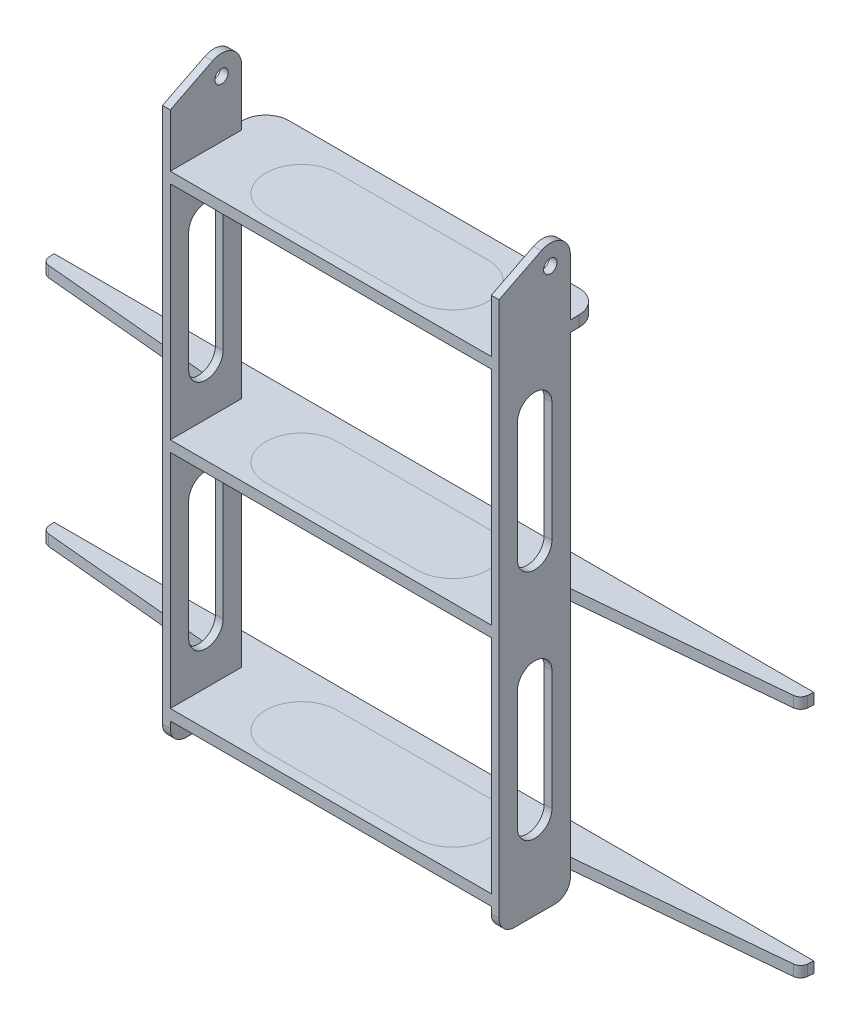
from build123d import *

# Parameters (mm, degrees)
SKETCH1_W               = 1237.47
SKETCH1_H               = 14
BOSS_EXTRUDE1_DEPTH     = 133
LPATTERN1_COUNT         = 3
LPATTERN1_PITCH         = 300
CUT_EXTRUDE1_DEPTH      = 882.76981136
CUT_EXTRUDE1_DEPTH_BACK = 882.76981136
SKETCH3_W               = 91.96189972
SKETCH3_H               = 741.26
BOSS_EXTRUDE2_DEPTH     = 10
SKETCH4_W               = 289.906679044
SKETCH4_H               = 376.133897458
CUT_EXTRUDE3_DEPTH      = 105
CUT_EXTRUDE5_DEPTH      = 960.881700163
CUT_EXTRUDE5_DEPTH_BACK = 960.881700163
SKETCH5_R               = 8.65
FILLET1_R               = 30
FILLET2_R               = 20
FILLET3_R               = 10
CUT_EXTRUDE6_DEPTH      = 960.881700163
CUT_EXTRUDE6_DEPTH_BACK = 960.881700163


with BuildPart() as part:
    # Sketch1 → Boss-Extrude1 (new body)
    with BuildSketch(Plane.XY):
        Rectangle(SKETCH1_W, SKETCH1_H)
    extrude(amount=BOSS_EXTRUDE1_DEPTH)


with BuildPart() as lpattern1_1:
    # LPattern1: pattern copy
    add(part.part.moved(Location(Vector(0, -1, 0) * (1 * LPATTERN1_PITCH))))


with BuildPart() as lpattern1_2:
    # LPattern1: pattern copy
    add(part.part.moved(Location(Vector(0, -1, 0) * (2 * LPATTERN1_PITCH))))


with BuildPart() as cut_extrude1_tool:
    # Sketch2 → Cut-Extrude1 (new, two sides: drawn at the far end of the back side and taken through both)
    with BuildSketch(Plane(origin=(0, 7, 0), x_dir=(1, 0, 0), z_dir=(0, 1, 0)).offset(-CUT_EXTRUDE1_DEPTH_BACK)):
        Polygon((-675.17481683, 0), (-675.17481683, -133), (-217.007056567, -133), (-217.007056567, -41.03810028), (-488.641898603, -15.743660333), (-489.975, 0), align=None)
        Polygon((489.975, 0), (675.17481683, 0), (675.17481683, -133), (217.007056567, -133), (217.007056567, -41.03810028), (488.641898603, -15.743660333), align=None)
    extrude(amount=CUT_EXTRUDE1_DEPTH + CUT_EXTRUDE1_DEPTH_BACK)


with BuildPart() as part_1:
    add(part.part)

    # Cut-Extrude1: cut by cut_extrude1_tool
    add(cut_extrude1_tool.part, mode=Mode.SUBTRACT)



with BuildPart() as lpattern1_1_1:
    add(lpattern1_1.part)

    # Cut-Extrude1: cut by cut_extrude1_tool
    add(cut_extrude1_tool.part, mode=Mode.SUBTRACT)


with BuildPart() as lpattern1_2_1:
    add(lpattern1_2.part)

    # Cut-Extrude1: cut by cut_extrude1_tool
    add(cut_extrude1_tool.part, mode=Mode.SUBTRACT)


with BuildPart() as part_2:
    add(part_1.part)

    add(lpattern1_1_1.part)  # Boss-Extrude2 merges LPattern1_1

    add(lpattern1_2_1.part)  # Boss-Extrude2 merges LPattern1_2
    # Sketch3 → Boss-Extrude2 (add)
    with BuildSketch(Plane.ZY.offset(217.007056567)):
        with Locations((87.01905014, -264.87)):
            Rectangle(SKETCH3_W, SKETCH3_H)
    boss_extrude2 = extrude(amount=-BOSS_EXTRUDE2_DEPTH)

    # Mirror1: Boss-Extrude2 across plane
    add(boss_extrude2.mirror(Plane(origin=(0, 0, 0), x_dir=(0, 0, 1), z_dir=(1, 0, 0))))

    # Sketch4 → Cut-Extrude3 (cut)
    with BuildSketch(Plane(origin=(0, 7, 0), x_dir=(1, 0, 0), z_dir=(0, 1, 0))):
        with Locations((-361.960396089, -44.135281773)):
            Rectangle(SKETCH4_W, SKETCH4_H)
        with Locations((361.960396089, -44.135281773)):
            Rectangle(SKETCH4_W, SKETCH4_H)
    extrude(amount=-CUT_EXTRUDE3_DEPTH, mode=Mode.SUBTRACT)

    # Sketch5 → Cut-Extrude5 (cut, two sides: drawn at the far end of the back side and taken through both)
    with BuildSketch(Plane(origin=(217.007056567, 0, 0), x_dir=(0, 0, -1), z_dir=(1, 0, 0)).offset(-CUT_EXTRUDE5_DEPTH_BACK)):
        with BuildLine():
            Line((-133, 105.76), (-133, 75.48))
            Line((-133, 75.48), (-78.550242405, 102.979525411))
            ThreePointArc((-78.550242405, 102.979525411), (-53.345094409, 101.921723933), (-41.03810028, 79.9))
            Line((-41.03810028, 79.9), (-41.03810028, 105.76))
            Line((-41.03810028, 105.76), (-133, 105.76))
        make_face()
        with Locations(Location((-66.89810028, 79.9, 0), (0, 0, 90))):
            Circle(SKETCH5_R)
    extrude(amount=CUT_EXTRUDE5_DEPTH + CUT_EXTRUDE5_DEPTH_BACK, mode=Mode.SUBTRACT)

    # Fillet1
    fillet1_edges = [part_2.edges().sort_by_distance(p)[0] for p in [
        (-217.007056567, 0, 0),
        (217.007056567, 0, 0),
    ]]
    fillet(fillet1_edges, radius=FILLET1_R)

    # Fillet2
    fillet2_edges = [part_2.edges().sort_by_distance(p)[0] for p in [
        (212.007056567, -635.5, 133),
        (212.007056567, -635.5, 41.03810028),
        (-212.007056567, -635.5, 41.03810028),
        (-212.007056567, -635.5, 133),
    ]]
    fillet(fillet2_edges, radius=FILLET2_R)

    # Fillet3
    fillet3_edges = [part_2.edges().sort_by_distance(p)[0] for p in [
        (488.641898603, -300, 15.743660333),
        (-488.641898603, -300, 15.743660333),
        (488.641898603, -600, 15.743660333),
        (-488.641898603, -600, 15.743660333),
    ]]
    fillet(fillet3_edges, radius=FILLET3_R)

    # Sketch6 → Cut-Extrude6 (cut, two sides: drawn at the far end of the back side and taken through both)
    with BuildSketch(Plane.ZY.offset(217.007056567).offset(-CUT_EXTRUDE6_DEPTH_BACK)):
        with BuildLine():
            Line((109.24905014, -73.05), (109.24905014, -226.95))
            ThreePointArc((109.24905014, -226.95), (87.01905014, -249.18), (64.78905014, -226.95))
            Line((64.78905014, -226.95), (64.78905014, -73.05))
            ThreePointArc((64.78905014, -73.05), (87.01905014, -50.82), (109.24905014, -73.05))
        make_face()
        with BuildLine():
            Line((109.24905014, -373.05), (109.24905014, -526.95))
            ThreePointArc((109.24905014, -526.95), (87.01905014, -549.18), (64.78905014, -526.95))
            Line((64.78905014, -526.95), (64.78905014, -373.05))
            ThreePointArc((64.78905014, -373.05), (87.01905014, -350.82), (109.24905014, -373.05))
        make_face()
    extrude(amount=CUT_EXTRUDE6_DEPTH + CUT_EXTRUDE6_DEPTH_BACK, mode=Mode.SUBTRACT)


solid = part_2.part
